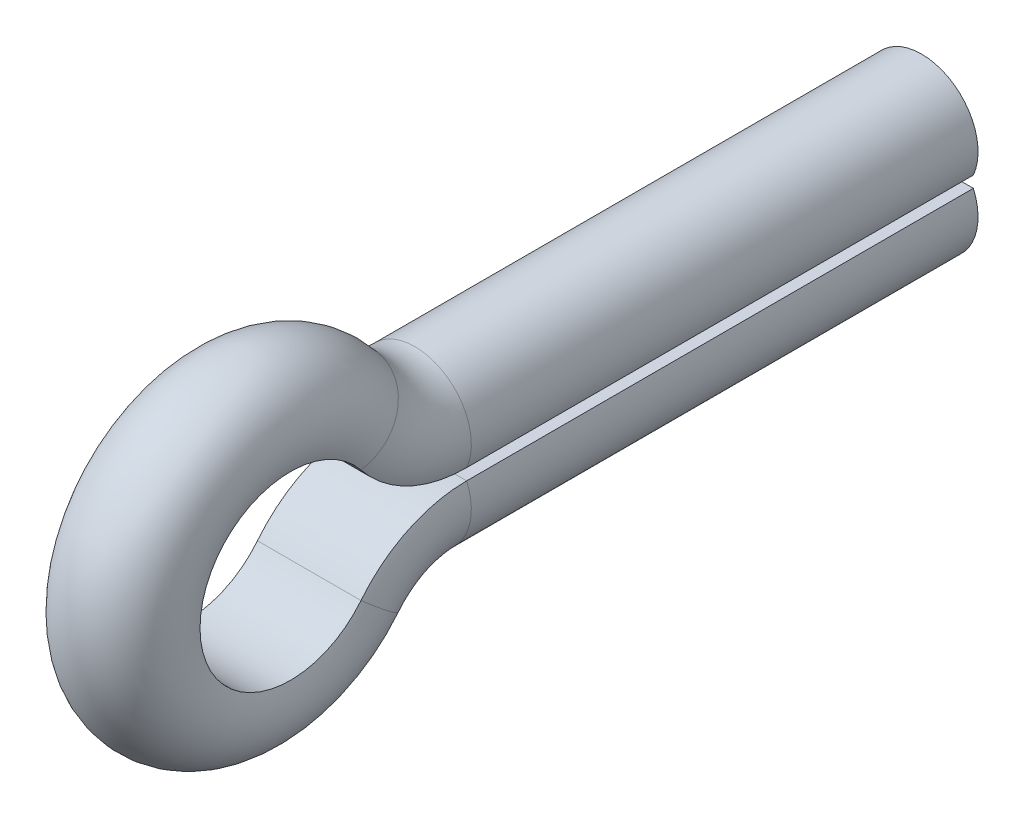
from build123d import *


with BuildPart() as part:
    # Sweep1: sweep along a path in Sketch1
    with BuildLine(Plane(origin=(0, 0, 0), x_dir=(0, 0, -1), z_dir=(1, 0, 0))) as sweep1_path:
        Line((30.24815072, 1.25), (7.806247498, 1.25))
        ThreePointArc((7.806247498, 1.25), (5.641183989, 1.743060906), (3.903123749, 3.125))
        ThreePointArc((3.903123749, 3.125), (-5, 0), (3.903123749, -3.125))
        ThreePointArc((3.903123749, -3.125), (5.641183989, -1.743060906), (7.806247498, -1.25))
        Line((7.806247498, -1.25), (30.24815072, -1.25))
    # Sketch5 → Sweep1 (sweep)
    with BuildSketch(Plane.XY.offset(-30.24815072)):
        with BuildLine():
            Line((-2.292644426, 0.253114081), (2.292644426, 0.253114081))
            ThreePointArc((2.292644426, 0.253114081), (0, 3.75), (-2.292644426, 0.253114081))
        make_face()
    sweep(path=sweep1_path.line)


solid = part.part
